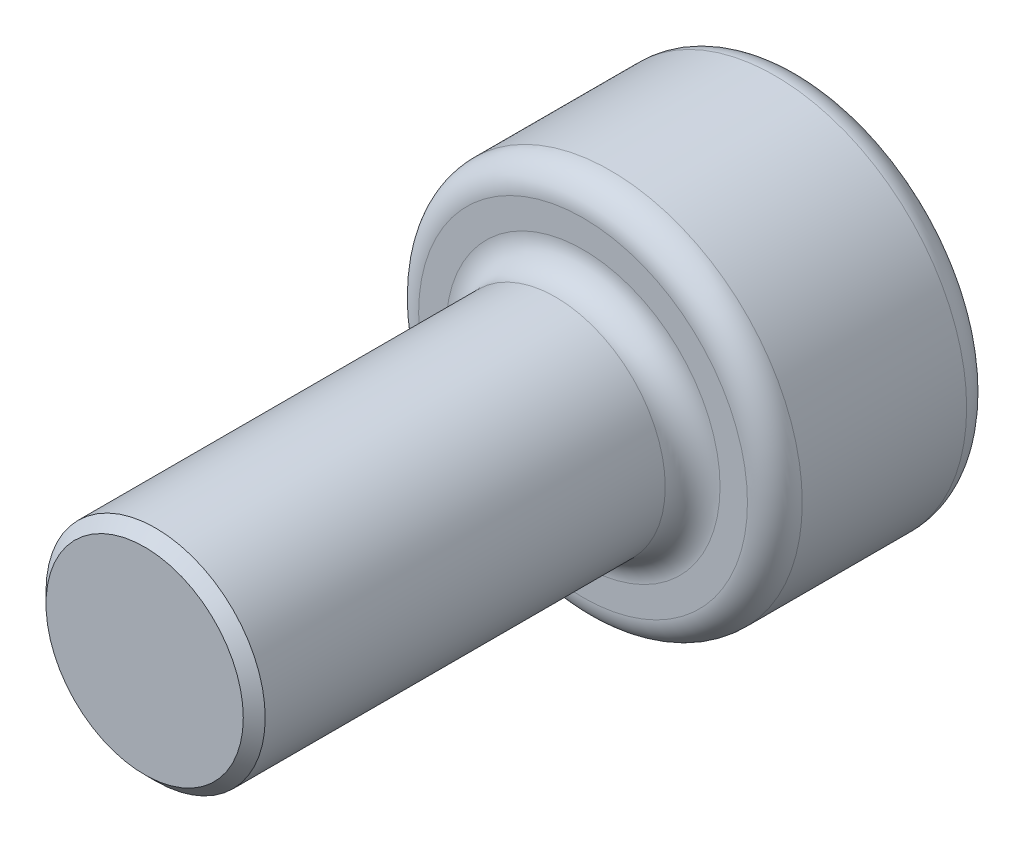
from build123d import *

# Parameters (mm, degrees)
SKETCH1_R           = 3.5
BOSS_EXTRUDE1_DEPTH = 4
SKETCH2_R           = 2
BOSS_EXTRUDE2_DEPTH = 8
CUT_EXTRUDE1_DEPTH  = 2.5
FILLET1_R           = 0.5
CHAMFER1_SIZE       = 0.2


with BuildPart() as part:
    # Sketch1 → Boss-Extrude1 (new body)
    with BuildSketch(Plane.XY):
        Circle(SKETCH1_R)
    extrude(amount=BOSS_EXTRUDE1_DEPTH)

    # Sketch2 → Boss-Extrude2 (add)
    with BuildSketch(Plane.XY.offset(4)):
        Circle(SKETCH2_R)
    extrude(amount=BOSS_EXTRUDE2_DEPTH)

    # Sketch3 → Cut-Extrude1 (cut)
    with BuildSketch(Plane(origin=(0, 0, 0), x_dir=(-1, 0, 0), z_dir=(0, 0, -1))):
        Polygon((2.020725942, 0), (1.010362971, 1.75), (-1.010362971, 1.75), (-2.020725942, 0), (-1.010362971, -1.75), (1.010362971, -1.75), align=None)
    extrude(amount=-CUT_EXTRUDE1_DEPTH, mode=Mode.SUBTRACT)

    # Fillet1
    fillet1_edges = [part.edges().sort_by_distance(p)[0] for p in [
        (-1.515544457, -0.875, 0),
        (-1.515544457, 0.875, 0),
        (0, 1.75, 0),
        (1.515544457, 0.875, 0),
        (1.515544457, -0.875, 0),
        (0, -1.75, 0),
        (-3.5, 0, 0),
        (-3.5, 0, 4),
        (-2, 0, 4),
    ]]
    fillet(fillet1_edges, radius=FILLET1_R)

    # Chamfer1
    chamfer1_edges = [part.edges().sort_by_distance(p)[0] for p in [
        (-2, 0, 12),
    ]]
    chamfer(chamfer1_edges, length=CHAMFER1_SIZE)


solid = part.part
